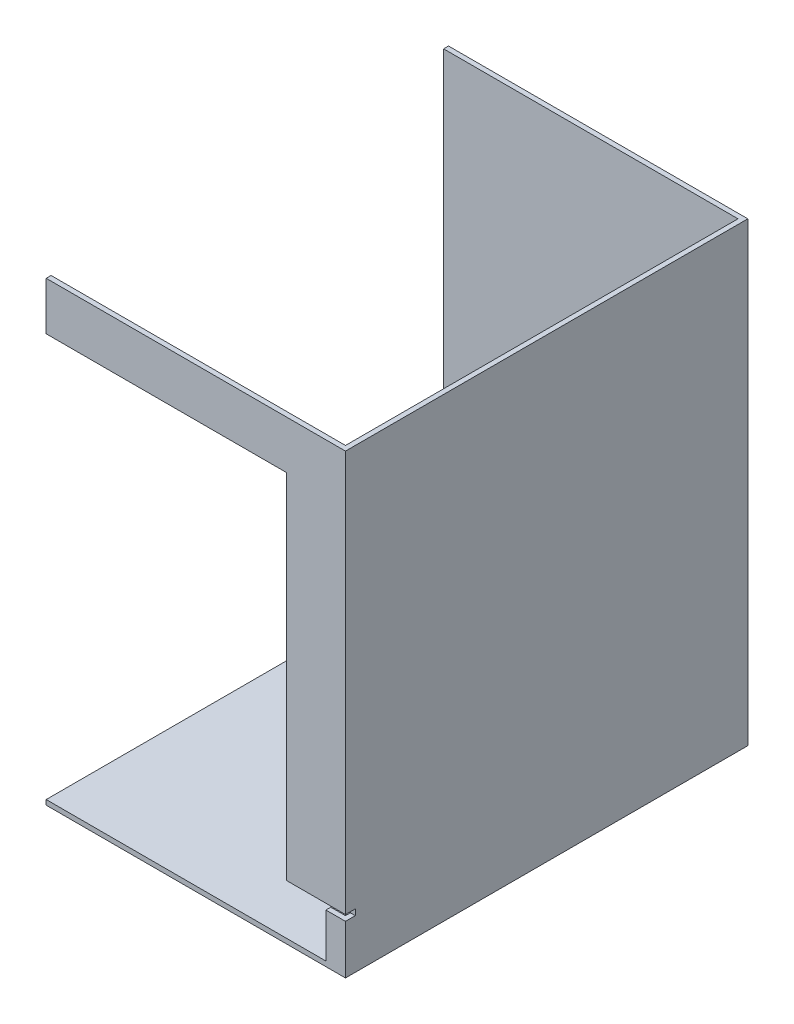
from build123d import *

# Parameters (mm, degrees)
SKETCH_8_W          = 150
SKETCH_8_H          = 200
EXTRUDE_3_DEPTH     = 230
SHELL_2_T           = 2.5
CUT_EXTRUDE_3_DEPTH = 5
SKETCH_11_W         = 142.5
SKETCH_11_H         = 22.5
CUT_EXTRUDE_4_DEPTH = 5


with BuildPart() as part:
    # 草图8 → 凸台-拉伸3 (new body)
    with BuildSketch(Plane(origin=(0, -2.5, 0), x_dir=(-1, 0, 0), z_dir=(0, -1, 0))):
        with Locations((-277.189390083, -102.212193571)):
            Rectangle(SKETCH_8_W, SKETCH_8_H)
    extrude(amount=-EXTRUDE_3_DEPTH)

    # 抽壳2
    shell_2_openings = [part.faces().sort_by_distance(p)[0] for p in [
        (202.189390083, 112.5, 102.212193571),
        (277.189390083, 227.5, 102.212193571),
    ]]
    offset(amount=SHELL_2_T, openings=shell_2_openings, kind=Kind.INTERSECTION)

    # 草图10 → 切除-拉伸3 (cut)
    with BuildSketch(Plane.XY.offset(204.712193571)):
        Polygon((354.689390083, 23), (324.689390083, 23), (324.689390083, 203), (202.189390083, 203), (202.189390083, 23), (202.189390083, 20), (354.689390083, 20), align=None)
    extrude(amount=-CUT_EXTRUDE_3_DEPTH, mode=Mode.SUBTRACT)

    # 草图11 → 切除-拉伸4 (cut)
    with BuildSketch(Plane.XY.offset(204.712193571)):
        with Locations((273.439390083, 8.75)):
            Rectangle(SKETCH_11_W, SKETCH_11_H)
    extrude(amount=-CUT_EXTRUDE_4_DEPTH, mode=Mode.SUBTRACT)


solid = part.part
